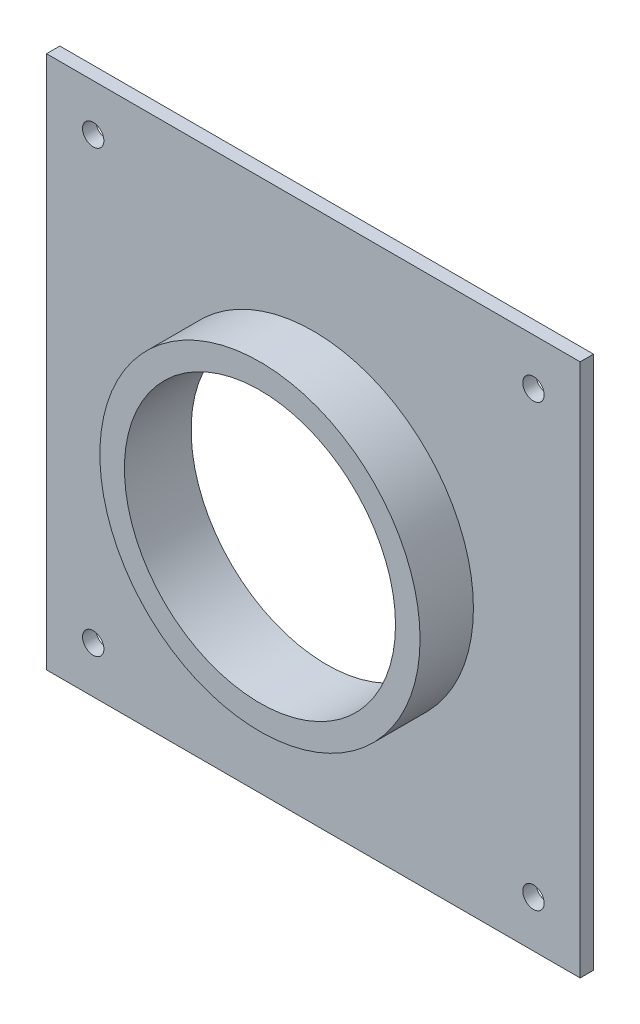
from build123d import *

# Parameters (mm, degrees)
SKETCH1_R             = 14
SKETCH1_R_2           = 10.16
BOSS_EXTRUDE1_DEPTH   = 5
SKETCH1_3_W           = 40
SKETCH1_3_H           = 40
SKETCH1_3_R           = 14
BOSS_EXTRUDE2_DEPTH   = 1
CUT_EXTRUDE1_START    = -4
SKETCH2_R             = 14
SKETCH2_R_2           = 12
CUT_EXTRUDE1_DEPTH    = 4
SKETCH3_W             = 1
SKETCH3_H             = 40
BOSS_EXTRUDE3_DEPTH   = 50
BOSS_EXTRUDE5_DEPTH   = 50
SKETCH5_W             = 40
SKETCH5_H             = 50
CUT_EXTRUDE2_DEPTH    = 22
M2_TAPPED_HOLE2_D     = 1.6
M2_TAPPED_HOLE2_DEPTH = 6
M2_TAPPED_HOLE2_TIP   = 0.480688495


with BuildPart() as part:
    # Sketch1 → Boss-Extrude1 (new body)
    with BuildSketch(Plane(origin=(0, 0, 0), x_dir=(0, 1, 0), z_dir=(0, 0, 1))):
        with Locations(Location((0, 0, 0), (0, 0, 270))):
            Circle(SKETCH1_R)
        with Locations(Location((0, 0, 0), (0, 0, 270))):
            Circle(SKETCH1_R_2, mode=Mode.SUBTRACT)
    extrude(amount=BOSS_EXTRUDE1_DEPTH)

    # Sketch1<3> → Boss-Extrude2 (add)
    with BuildSketch(Plane(origin=(0, 0, 0), x_dir=(0, 1, 0), z_dir=(0, 0, 1))):
        Rectangle(SKETCH1_3_W, SKETCH1_3_H)
        with Locations(Location((0, 0, 0), (0, 0, 270))):
            Circle(SKETCH1_3_R, mode=Mode.SUBTRACT)
    extrude(amount=BOSS_EXTRUDE2_DEPTH)

    # Sketch2 → Cut-Extrude1 (cut)
    with BuildSketch(Plane.XY.offset(5).offset(CUT_EXTRUDE1_START)):
        Circle(SKETCH2_R)
        Circle(SKETCH2_R_2, mode=Mode.SUBTRACT)
    extrude(amount=CUT_EXTRUDE1_DEPTH, mode=Mode.SUBTRACT)

    # Sketch3 → Boss-Extrude3 (add)
    with BuildSketch(Plane.XY.offset(1)):
        with Locations((-19.5, 0)):
            Rectangle(SKETCH3_W, SKETCH3_H)
    extrude(amount=BOSS_EXTRUDE3_DEPTH)

    # Sketch4 → Boss-Extrude5 (add)
    with BuildSketch(Plane.XY.offset(51)):
        Polygon((-17, 5), (-19, 4), (-19, 0), (-19, -4), (-17, -5), align=None)
    extrude(amount=-BOSS_EXTRUDE5_DEPTH)

    # Sketch5 → Cut-Extrude2 (cut)
    with BuildSketch(Plane.YZ.offset(-17)):
        with Locations((0, 26)):
            Rectangle(SKETCH5_W, SKETCH5_H)
    extrude(amount=-CUT_EXTRUDE2_DEPTH, mode=Mode.SUBTRACT)

    # M2 Tapped Hole2
    with Locations(Plane.XY.offset(1)):
        with Locations((-16.5, -16.5), (-16.5, 16.5), (16.5, 16.5), (16.5, -16.5)):
            Hole(M2_TAPPED_HOLE2_D / 2, depth=M2_TAPPED_HOLE2_DEPTH)
            with Locations((0, 0, -(M2_TAPPED_HOLE2_DEPTH + M2_TAPPED_HOLE2_TIP / 2))):  # 118° drill point
                Cone(0, M2_TAPPED_HOLE2_D / 2, M2_TAPPED_HOLE2_TIP, mode=Mode.SUBTRACT)


solid = part.part
